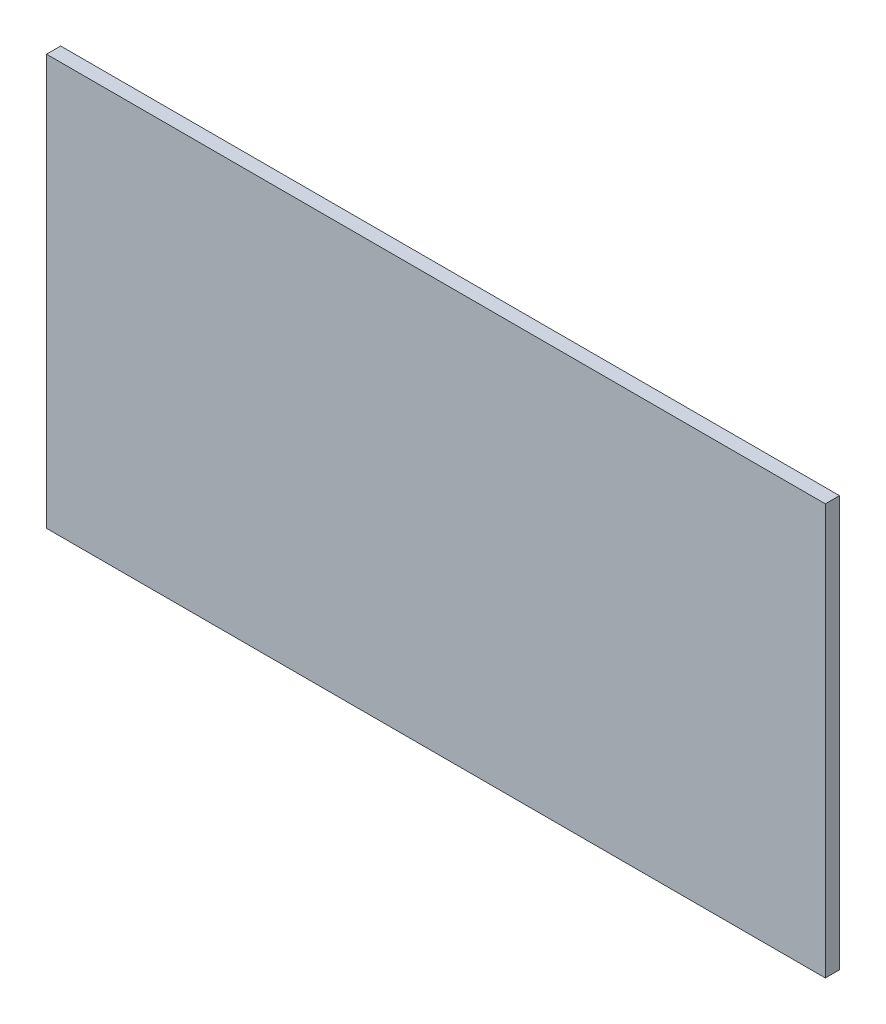
from build123d import *

# Parameters (mm, degrees)
ESQUISSE1_W        = 330
ESQUISSE1_H        = 174
BOSS_EXTRU_1_DEPTH = 6


with BuildPart() as part:
    # Esquisse1 → Boss.-Extru.1 (new body)
    with BuildSketch(Plane.XY):
        with Locations((-165, 87)):
            Rectangle(ESQUISSE1_W, ESQUISSE1_H)
    extrude(amount=BOSS_EXTRU_1_DEPTH)


solid = part.part
